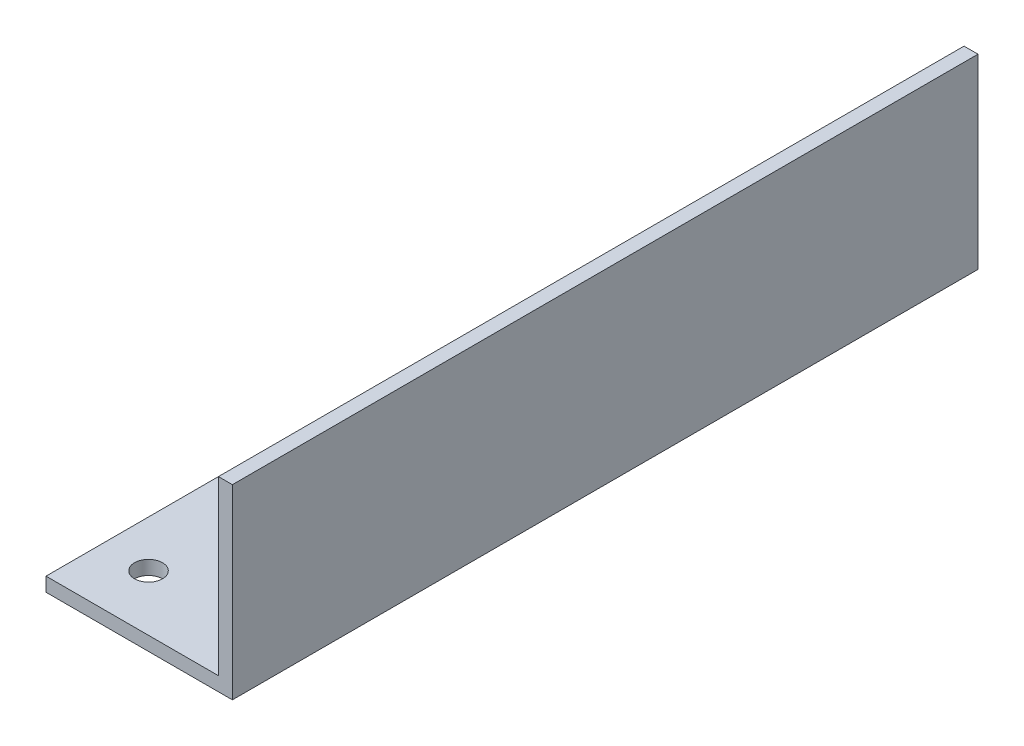
from build123d import *

# Parameters (mm, degrees)
EXTRUSION1_DEPTH = 80
ESQUISSE2_R      = 1.5
EXTRUSION2_DEPTH = 80


with BuildPart() as part:
    # Esquisse1 → Extrusion1 (new body)
    with BuildSketch(Plane.XY):
        Polygon((-29.286808535, 12.129808714), (-29.286808535, 10.629808714), (-9.286808535, 10.629808714), (-9.286808535, 30.629808714), (-10.786808535, 30.629808714), (-10.786808535, 12.129808714), align=None)
    extrude(amount=EXTRUSION1_DEPTH)

    # Esquisse2 → Extrusion2 (cut)
    with BuildSketch(Plane.XZ.offset(-10.629808714)):
        with Locations(Location((-14.286808535, 74, 0), (0, 0, 270))):
            Circle(ESQUISSE2_R)
        with Locations(Location((-24.286808535, 74, 0), (0, 0, 270))):
            Circle(ESQUISSE2_R)
        with Locations(Location((-14.286808535, 16, 0), (0, 0, 270))):
            Circle(ESQUISSE2_R)
        with Locations(Location((-24.286808535, 10, 0), (0, 0, 270))):
            Circle(ESQUISSE2_R)
        with Locations(Location((-19.286808535, 40, 0), (0, 0, 270))):
            Circle(ESQUISSE2_R)
    extrude(amount=-EXTRUSION2_DEPTH, mode=Mode.SUBTRACT)


solid = part.part
